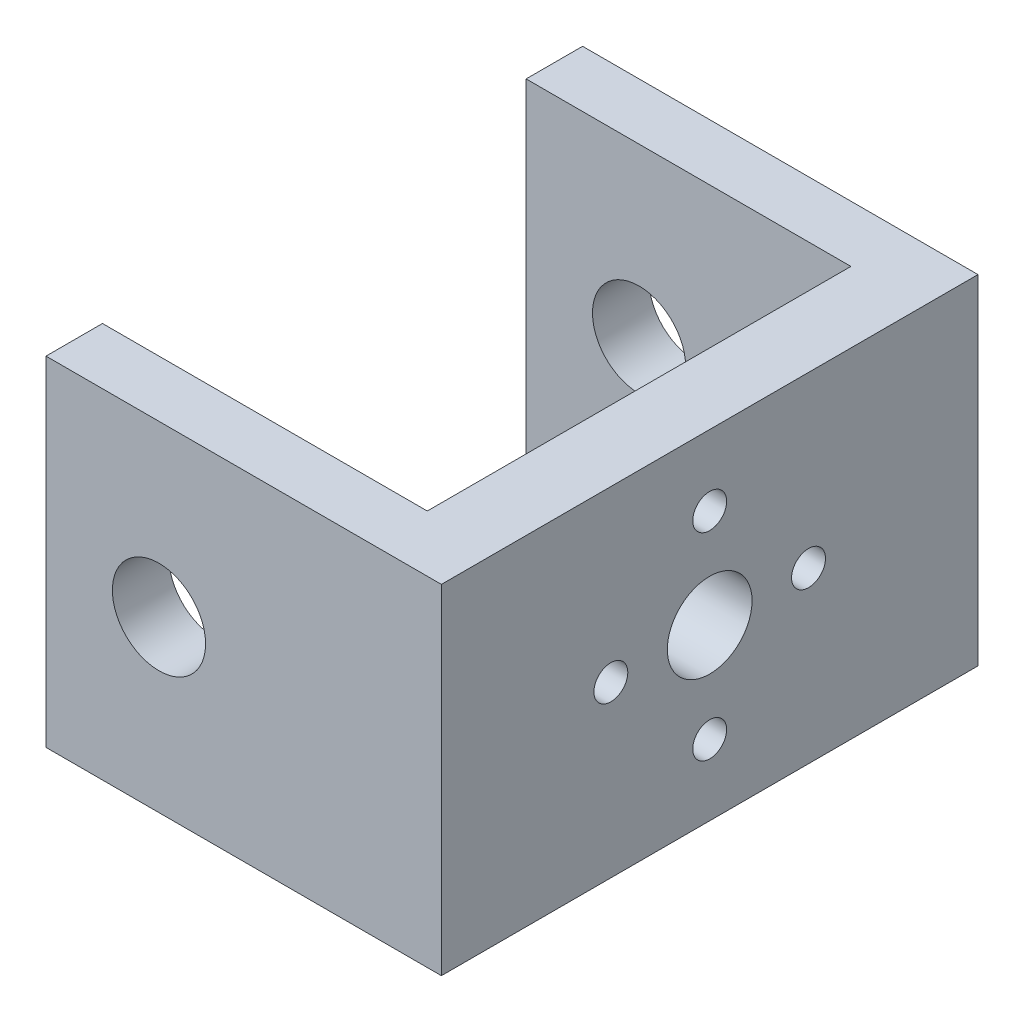
from build123d import *

# Parameters (mm, degrees)
SKETCH1_W            = 28
SKETCH1_H            = 24
BOSS_EXTRUDE1_DEPTH  = 4
SKETCH3_W            = 5
SKETCH3_H            = 24
BOSS_EXTRUDE2_DEPTH  = 30
LPATTERN1_COUNT      = 2
LPATTERN1_PITCH      = 34
M6_CLEARANCE_HOLE1_D = 6.6
CUT_EXTRUDE1_REACH   = 52.16
SKETCH8_R            = 3
SKETCH8_R_2          = 1.2
CIRPATTERN1_COUNT    = 4


with BuildPart() as part:
    # Sketch1 → Boss-Extrude1 (new body)
    with BuildSketch(Plane.XY):
        with Locations((14, 12)):
            Rectangle(SKETCH1_W, SKETCH1_H)
    boss_extrude1 = extrude(amount=BOSS_EXTRUDE1_DEPTH)

    # Sketch3 → Boss-Extrude2 (add)
    with BuildSketch(Plane(origin=(0, 0, 0), x_dir=(-1, 0, 0), z_dir=(0, 0, -1))):
        with Locations((-25.5, 12)):
            Rectangle(SKETCH3_W, SKETCH3_H)
    extrude(amount=BOSS_EXTRUDE2_DEPTH)

    # LPattern1: Boss-Extrude1 ×2
    with Locations(*[(0, 0, -i * LPATTERN1_PITCH) for i in range(1, LPATTERN1_COUNT)]):
        add(boss_extrude1)

    # M6 Clearance Hole1 (through all)
    with Locations(Plane.XY.offset(4)):
        with Locations((8, 12)):
            Hole(M6_CLEARANCE_HOLE1_D / 2)

    # Sketch8 → Cut-Extrude1 (cut, up to next)
    with BuildSketch(Plane(origin=(28, 0, 0), x_dir=(0, 0, -1), z_dir=(1, 0, 0)), mode=Mode.PRIVATE) as cut_extrude1_sk1:
        with Locations((15, 12)):
            Circle(SKETCH8_R)
    cut_extrude1_tool1 = extrude(cut_extrude1_sk1.sketch, amount=-CUT_EXTRUDE1_REACH, mode=Mode.PRIVATE) & part.part
    # Sketch8 → Cut-Extrude1 (cut, up to next)
    with BuildSketch(Plane(origin=(28, 0, 0), x_dir=(0, 0, -1), z_dir=(1, 0, 0)), mode=Mode.PRIVATE) as cut_extrude1_sk2:
        with Locations((8, 12)):
            Circle(SKETCH8_R_2)
    cut_extrude1_tool2 = extrude(cut_extrude1_sk2.sketch, amount=-CUT_EXTRUDE1_REACH, mode=Mode.PRIVATE) & part.part
    cut_extrude1_1 = cut_extrude1_tool1.solids().sort_by_distance((28, 12, -15))[0]
    add(cut_extrude1_1, mode=Mode.SUBTRACT)
    cut_extrude1_2 = cut_extrude1_tool2.solids().sort_by_distance((28, 12, -8))[0]
    add(cut_extrude1_2, mode=Mode.SUBTRACT)
    cut_extrude1 = cut_extrude1_1 + cut_extrude1_2  # Cut-Extrude1 as one shape, for the pattern or mirror that repeats it

    # CirPattern1: Cut-Extrude1 ×4 about axis
    cirpattern1_axis = Axis((0, 12, -15), (1, 0, 0))
    for i in range(1, CIRPATTERN1_COUNT):
        add(cut_extrude1.rotate(cirpattern1_axis, i * 360 / CIRPATTERN1_COUNT), mode=Mode.SUBTRACT)


solid = part.part
